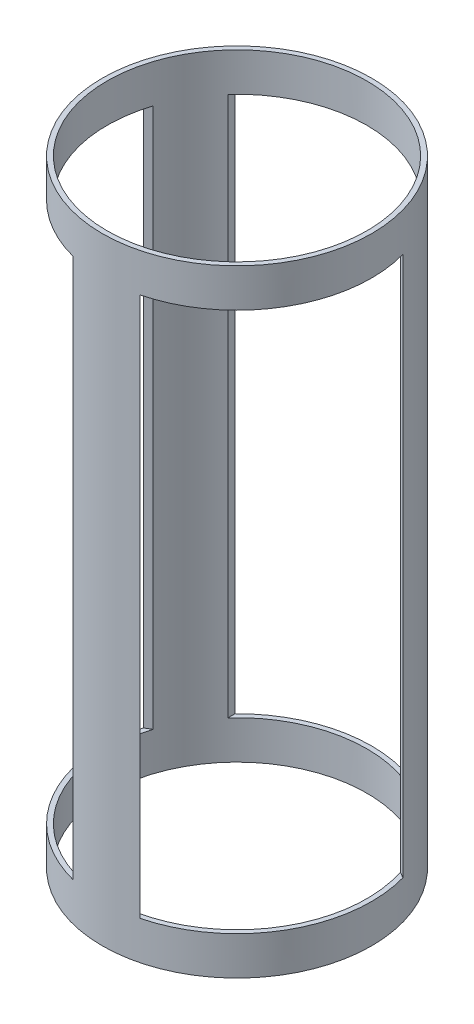
from build123d import *

# Parameters (mm, degrees)
SKETCH1_R               = 88.9
SKETCH1_R_2             = 85.725
BOSS_EXTRUDE1_DEPTH     = 203.581
CUT_EXTRUDE1_REACH      = 241.273
CUT_EXTRUDE1_END_RADIUS = 88.9
SKETCH2_W               = 127
SKETCH2_H               = 356.362
CIRPATTERN1_COUNT       = 3


with BuildPart() as part:
    # Sketch1 → Boss-Extrude1 (new, symmetric)
    with BuildSketch(Plane(origin=(0, 0, 0), x_dir=(1, 0, 0), z_dir=(0, 1, 0))):
        with Locations(Location((0, 0, 0), (0, 0, 270))):
            Circle(SKETCH1_R)
        with Locations(Location((0, 0, 0), (0, 0, 270))):
            Circle(SKETCH1_R_2, mode=Mode.SUBTRACT)
    extrude(amount=BOSS_EXTRUDE1_DEPTH, both=True)

    # Cut-Extrude1: up to this cylinder (the profile starts inside it)
    cut_extrude1_end = Plane(origin=(0, 0, 0), z_dir=(0, -1, 0)) * Cylinder(CUT_EXTRUDE1_END_RADIUS, 661.346, mode=Mode.PRIVATE)
    # Sketch2 → Cut-Extrude1 (cut, up to the surface)
    with BuildSketch(Plane.XY, mode=Mode.PRIVATE) as cut_extrude1_sk1:
        Rectangle(SKETCH2_W, SKETCH2_H)
    cut_extrude1_tool1 = extrude(cut_extrude1_sk1.sketch, amount=-CUT_EXTRUDE1_REACH, mode=Mode.PRIVATE) & cut_extrude1_end
    cut_extrude1 = cut_extrude1_tool1.solids().sort_by_distance((0, 0, 0))[0]
    add(cut_extrude1, mode=Mode.SUBTRACT)

    # CirPattern1: Cut-Extrude1 ×3 about axis
    cirpattern1_axis = Axis((0, 0, 0), (0, 1, 0))
    for i in range(1, CIRPATTERN1_COUNT):
        add(cut_extrude1.rotate(cirpattern1_axis, i * 360 / CIRPATTERN1_COUNT), mode=Mode.SUBTRACT)


solid = part.part
